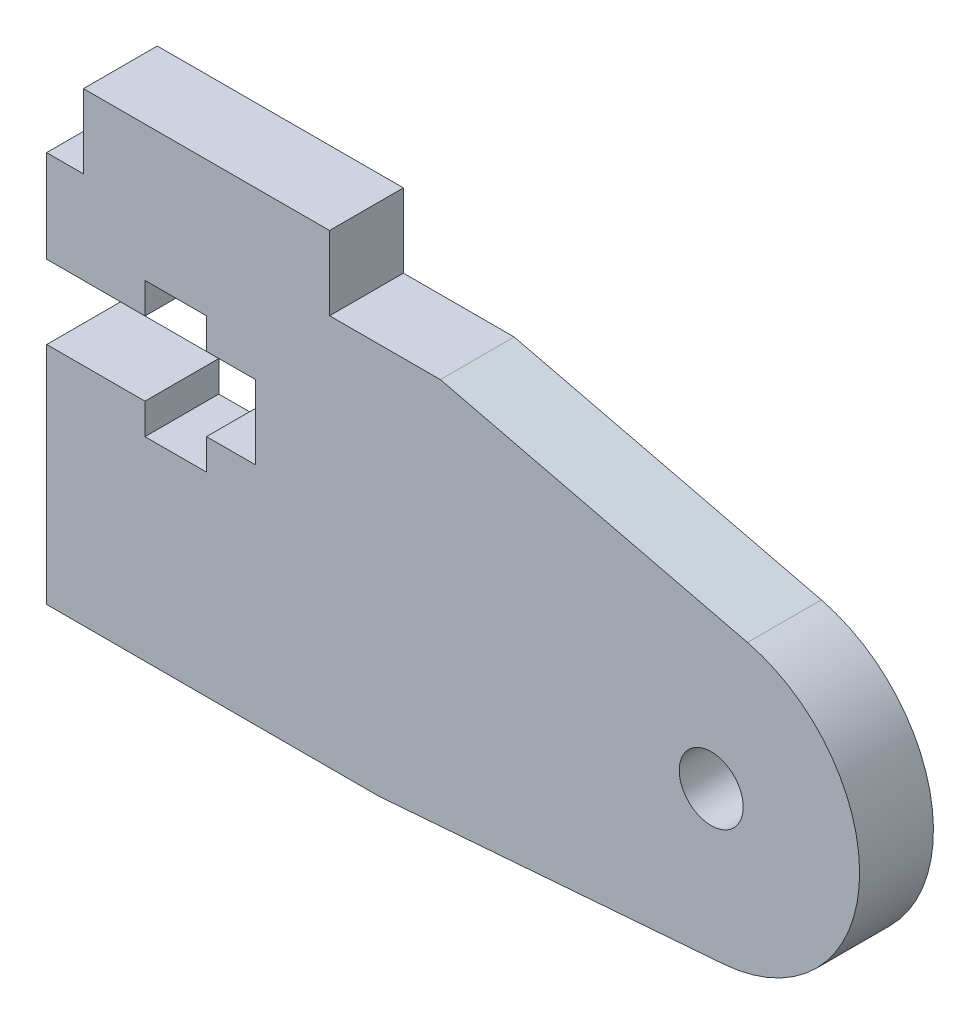
from build123d import *

# Parameters (mm, degrees)
SKETCH_1_R      = 1.3
EXTRUDE_1_DEPTH = 3


with BuildPart() as part:
    # 草圖1 → 填料-伸長1 (new body)
    with BuildSketch(Plane.XY):
        with BuildLine():
            Line((216.492632944, 78.234092132), (216.493617135, 76.984092519))
            Line((216.493617135, 76.984092519), (213.99361791, 76.982124137))
            Line((213.99361791, 76.982124137), (213.992633719, 78.23212375))
            Line((213.992633719, 78.23212375), (210.000112684, 78.228980226))
            Line((210.000112684, 78.228980226), (209.999867004, 69.08))
            Line((209.999867004, 69.08), (223.48824264, 69.08))
            Line((223.48824264, 69.08), (237.517934203, 70.178792238))
            ThreePointArc((237.517934203, 70.178792238), (243.012429177, 75.673064936), (238.477244304, 81.982471062))
            Line((238.477244304, 81.982471062), (225.994777469, 84.991510945))
            Line((225.994777469, 84.991510945), (221.494778864, 84.987967857))
            Line((221.494778864, 84.987967857), (221.492416806, 87.987966928))
            Line((221.492416806, 87.987966928), (211.492419905, 87.980093399))
            Line((211.492419905, 87.980093399), (211.494781964, 84.980094329))
            Line((211.494781964, 84.980094329), (209.994782429, 84.9789133))
            Line((209.994782429, 84.9789133), (209.997745798, 81.228979292))
            Line((209.997745798, 81.228979292), (213.997733688, 81.232128695))
            Line((213.997733688, 81.232128695), (213.996749497, 82.482128308))
            Line((213.996749497, 82.482128308), (216.489286694, 82.484090815))
            Line((216.489286694, 82.484090815), (216.490270885, 81.234091202))
            Line((216.490270885, 81.234091202), (218.490270265, 81.235665908))
            Line((218.490270265, 81.235665908), (218.492632324, 78.235666838))
            Line((218.492632324, 78.235666838), (216.492632944, 78.234092132))
        make_face()
        with Locations((237.0017815, 76.100174585)):
            Circle(SKETCH_1_R, mode=Mode.SUBTRACT)
    extrude(amount=EXTRUDE_1_DEPTH)


solid = part.part
